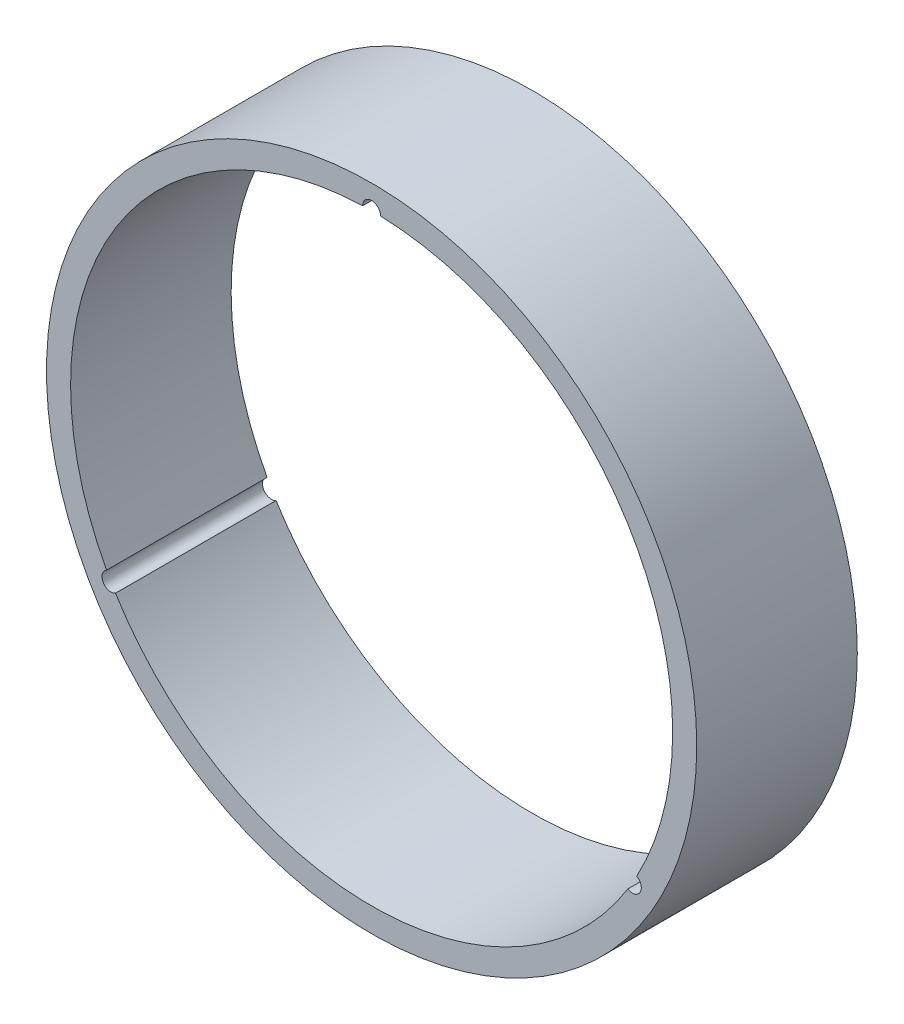
from build123d import *

# Parameters (mm, degrees)
SKETCH1_R           = 81
BOSS_EXTRUDE1_DEPTH = 40


with BuildPart() as part:
    # Sketch1 → Boss-Extrude1 (new body)
    with BuildSketch(Plane.XY):
        Circle(SKETCH1_R)
        with BuildLine():
            ThreePointArc((2.231689825, 74.966789717), (53.816246324, 52.238028596), (75, 0))
            ThreePointArc((75, 0), (72.725250751, -18.331336645), (66.038989248, -35.550694777))
            ThreePointArc((66.038989248, -35.550694777), (66.876463055, -36.369681556), (67.1838422, -37.5))
            ThreePointArc((67.1838422, -37.5), (66.053461983, -39.441163372), (63.807299423, -39.416094941))
            ThreePointArc((63.807299423, -39.416094941), (0, -75), (-63.807299423, -39.416094941))
            ThreePointArc((-63.807299423, -39.416094941), (-66.884819353, -38.615968458), (-66.038989248, -35.550694777))
            ThreePointArc((-66.038989248, -35.550694777), (-64.951905284, 37.5), (-2.231689825, 74.966789717))
            ThreePointArc((-2.231689825, 74.966789717), (-0.016605601, 77.231875143), (2.231936916, 75))
            ThreePointArc((2.231936916, 75), (2.231875143, 74.983394399), (2.231689825, 74.966789717))
        make_face(mode=Mode.SUBTRACT)
    extrude(amount=BOSS_EXTRUDE1_DEPTH)


solid = part.part
